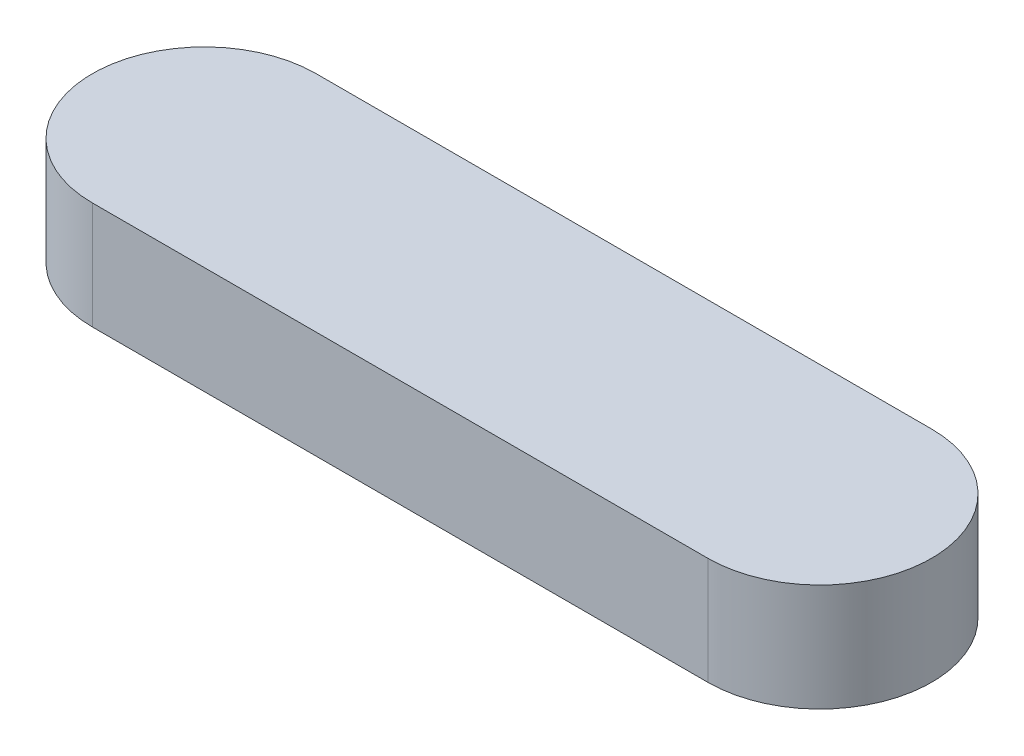
from build123d import *

# Parameters (mm, degrees)
BOSS_EXTRUDE1_DEPTH = 3.84


with BuildPart() as part:
    # Sketch1 → Boss-Extrude1 (new body)
    with BuildSketch(Plane(origin=(0, 0, 0), x_dir=(1, 0, 0), z_dir=(0, 1, 0))):
        with BuildLine():
            Line((11, -4), (-11, -4))
            ThreePointArc((-11, -4), (-15, 0), (-11, 4))
            Line((-11, 4), (11, 4))
            ThreePointArc((11, 4), (15, 0), (11, -4))
        make_face()
    extrude(amount=BOSS_EXTRUDE1_DEPTH)


solid = part.part
